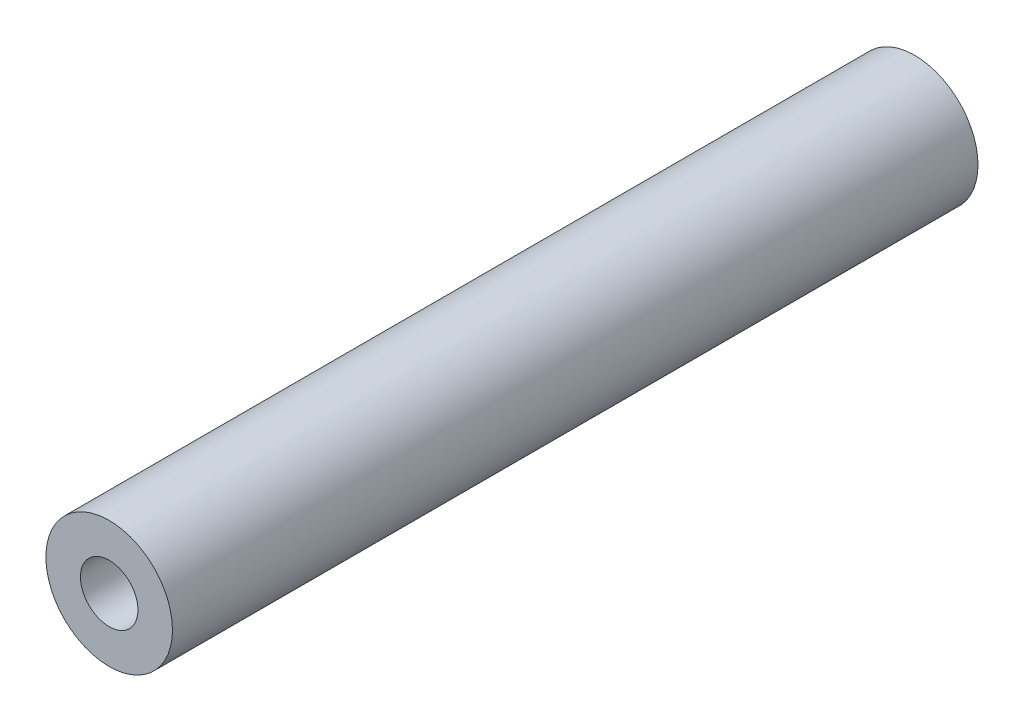
from build123d import *

# Parameters (mm, degrees)
ESQUISSE1_R             = 2.75
BOSS_EXTRU_1_DEPTH      = 35
ENL_V_MAT_EXTRU_1_REACH = 37.215
ESQUISSE2_R             = 1.25


with BuildPart() as part:
    # Esquisse1 → Boss.-Extru.1 (new body)
    with BuildSketch(Plane.XY):
        Circle(ESQUISSE1_R)
    extrude(amount=BOSS_EXTRU_1_DEPTH)

    # Esquisse2 → Enlèv. mat.-Extru.1 (cut, up to next)
    with BuildSketch(Plane.XY.offset(35), mode=Mode.PRIVATE) as enl_v_mat_extru_1_sk1:
        Circle(ESQUISSE2_R)
    enl_v_mat_extru_1_tool1 = extrude(enl_v_mat_extru_1_sk1.sketch, amount=-ENL_V_MAT_EXTRU_1_REACH, mode=Mode.PRIVATE) & part.part
    add(enl_v_mat_extru_1_tool1.solids().sort_by_distance((0, 0, 35))[0], mode=Mode.SUBTRACT)


solid = part.part
